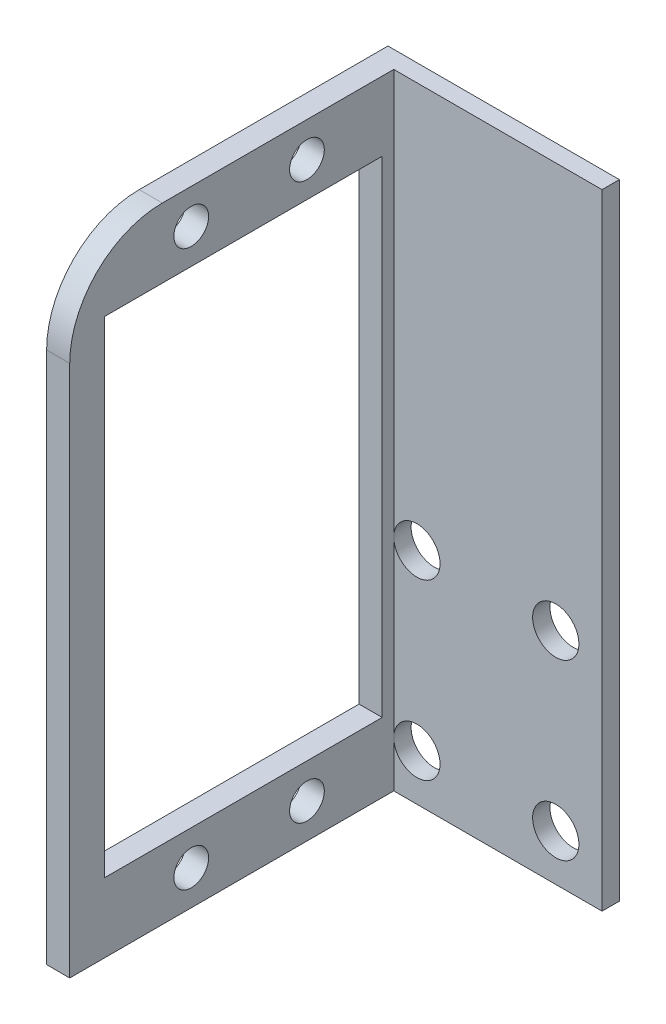
from build123d import *

# Parameters (mm, degrees)
SKETCH_1_W      = 28
SKETCH_1_H      = 54
SKETCH_1_R      = 1.5
SKETCH_1_W_2    = 24
SKETCH_1_H_2    = 42
EXTRUDE_1_DEPTH = 2
SKETCH_2_W      = 20
SKETCH_2_H      = 54
SKETCH_2_R      = 2
EXTRUDE_2_DEPTH = 1.5
FILLET_1_R      = 8


with BuildPart() as part:
    # 草图1 → 凸台-拉伸1 (new body)
    with BuildSketch(Plane(origin=(0, 0, 0), x_dir=(0, 0, -1), z_dir=(1, 0, 0))):
        with Locations((-14, 27)):
            Rectangle(SKETCH_1_W, SKETCH_1_H)
        with Locations((-7.5, 51)):
            Circle(SKETCH_1_R, mode=Mode.SUBTRACT)
        with Locations((-17.5, 51)):
            Circle(SKETCH_1_R, mode=Mode.SUBTRACT)
        with Locations(Location((-7.5, 3, 0), (0, 0, 180))):
            Circle(SKETCH_1_R, mode=Mode.SUBTRACT)
        with Locations(Location((-17.5, 3, 0), (0, 0, 180))):
            Circle(SKETCH_1_R, mode=Mode.SUBTRACT)
        with Locations((-13, 27)):
            Rectangle(SKETCH_1_W_2, SKETCH_1_H_2, mode=Mode.SUBTRACT)
    extrude(amount=EXTRUDE_1_DEPTH)

    # 草图2 → 凸台-拉伸2 (add)
    with BuildSketch(Plane(origin=(0, 0, 0), x_dir=(-1, 0, 0), z_dir=(0, 0, -1))):
        with Locations((-10, 27)):
            Rectangle(SKETCH_2_W, SKETCH_2_H)
        with Locations(Location((-16, 4, 0), (0, 0, 90))):
            Circle(SKETCH_2_R, mode=Mode.SUBTRACT)
        with Locations((-4, 4)):
            Circle(SKETCH_2_R, mode=Mode.SUBTRACT)
        with Locations(Location((-4, 19, 0), (0, 0, 270))):
            Circle(SKETCH_2_R, mode=Mode.SUBTRACT)
        with Locations(Location((-16, 19, 0), (0, 0, 270))):
            Circle(SKETCH_2_R, mode=Mode.SUBTRACT)
    extrude(amount=EXTRUDE_2_DEPTH)

    # 圆角1
    fillet_1_edges = [part.edges().sort_by_distance(p)[0] for p in [
        (1, 54, 28),
    ]]
    fillet(fillet_1_edges, radius=FILLET_1_R)


solid = part.part
